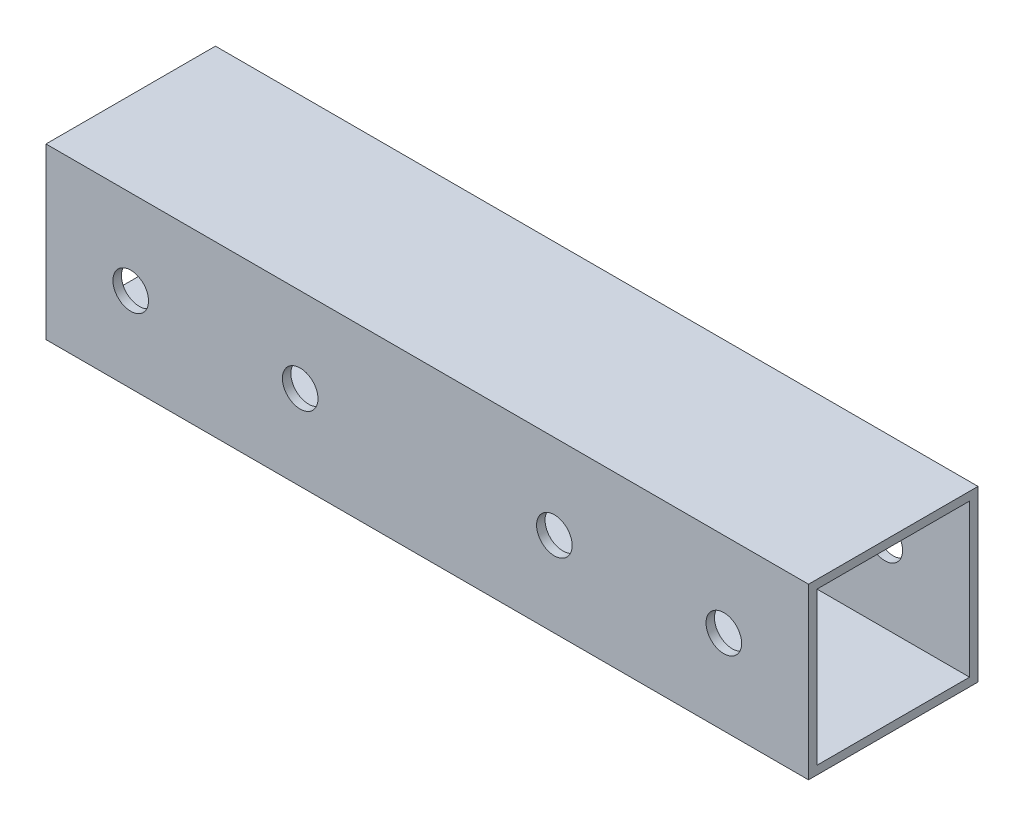
from build123d import *

# Parameters (mm, degrees)
SKETCH_1_W          = 20
SKETCH_1_H          = 20
EXTRUDE_1_DEPTH     = 90
SKETCH_2_R          = 2.1
CUT_EXTRUDE_1_DEPTH = 93.736184955
SKETCH_3_W          = 18
SKETCH_3_H          = 18
CUT_EXTRUDE_2_DEPTH = 92.104335791


with BuildPart() as part:
    # 草图1 → 凸台-拉伸1 (new body)
    with BuildSketch(Plane(origin=(0, 0, 0), x_dir=(0, 0, -1), z_dir=(1, 0, 0))):
        Rectangle(SKETCH_1_W, SKETCH_1_H)
    extrude(amount=EXTRUDE_1_DEPTH)

    # 草图2 → 切除-拉伸1 (cut, through all)
    with BuildSketch(Plane.XY.offset(10)):
        with Locations((10, 0)):
            Circle(SKETCH_2_R)
        with Locations((30, 0)):
            Circle(SKETCH_2_R)
        with Locations(Location((60, 0, 0), (0, 0, 180))):
            Circle(SKETCH_2_R)
        with Locations(Location((80, 0, 0), (0, 0, 180))):
            Circle(SKETCH_2_R)
    extrude(amount=-CUT_EXTRUDE_1_DEPTH, mode=Mode.SUBTRACT)

    # 草图3 → 切除-拉伸2 (cut, through all)
    with BuildSketch(Plane.ZY):
        Rectangle(SKETCH_3_W, SKETCH_3_H)
    extrude(amount=-CUT_EXTRUDE_2_DEPTH, mode=Mode.SUBTRACT)


solid = part.part
